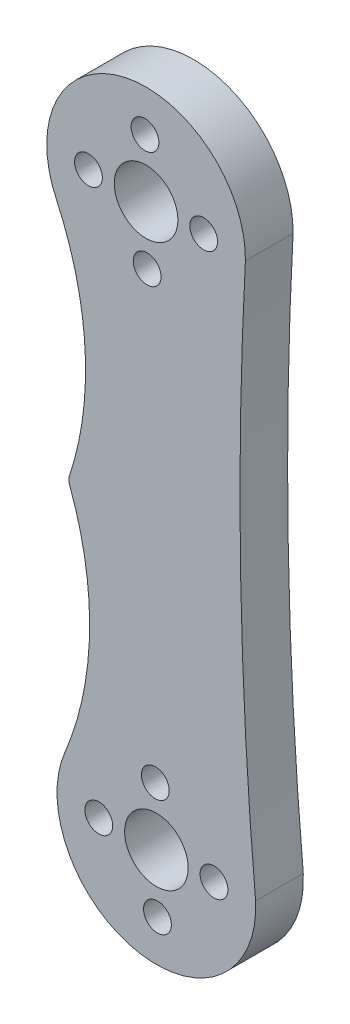
from build123d import *

# Parameters (mm, degrees)
SKETCH1_W           = 30
SKETCH1_H           = 100
BOSS_EXTRUDE1_DEPTH = 6
SKETCH2_W           = 30
SKETCH2_H           = 100
SKETCH2_R           = 4
SKETCH2_R_2         = 1.75
CUT_EXTRUDE1_DEPTH  = 6


with BuildPart() as part:
    # Sketch1 → Boss-Extrude1 (new body)
    with BuildSketch(Plane.XY):
        Rectangle(SKETCH1_W, SKETCH1_H)
    extrude(amount=BOSS_EXTRUDE1_DEPTH)

    # Sketch2 → Cut-Extrude1 (cut)
    # profile 1 of 11: a face of its own
    with BuildSketch(Plane(origin=(0, 0, 0), x_dir=(-1, 0, 0), z_dir=(0, 0, -1))):
        Rectangle(SKETCH2_W, SKETCH2_H)
        with BuildLine():
            ThreePointArc((-11.532456366, 35.433789865), (-10.931527192, 0.86004689), (-12.814966119, -33.667586637))
            ThreePointArc((-12.814966119, -33.667586637), (1.804726533, -46.658495876), (11.190763167, -29.50036508))
            ThreePointArc((11.190763167, -29.50036508), (8.075913228, -14.826459902), (10.585521288, -0.037016008))
            ThreePointArc((10.585521288, -0.037016008), (10.679689693, 0.458946393), (10.603989757, 0.958061522))
            ThreePointArc((10.603989757, 0.958061522), (8.644900126, 15.830443683), (12.302107664, 30.37866063))
            ThreePointArc((12.302107664, 30.37866063), (12.787952713, 31.585012611), (13.145828199, 32.835314836))
            ThreePointArc((13.145828199, 32.835314836), (2.274693549, 48.076541281), (-11.532456366, 35.433789865))
        make_face(mode=Mode.SUBTRACT)
    # profile 2 of 11: a face of its own
    with BuildSketch(Plane(origin=(0, 0, 0), x_dir=(-1, 0, 0), z_dir=(0, 0, -1))):
        with Locations((0.965754671, 35.645263027)):
            Circle(SKETCH2_R)
    # profile 3 of 11: a face of its own
    with BuildSketch(Plane(origin=(0, 0, 0), x_dir=(-1, 0, 0), z_dir=(0, 0, -1))):
        with Locations((1.100290264, 42.894014656)):
            Circle(SKETCH2_R_2)
    # profile 4 of 11: a face of its own
    with BuildSketch(Plane(origin=(0, 0, 0), x_dir=(-1, 0, 0), z_dir=(0, 0, -1))):
        with Locations((8.214506299, 35.510727434)):
            Circle(SKETCH2_R_2)
    # profile 5 of 11: a face of its own
    with BuildSketch(Plane(origin=(0, 0, 0), x_dir=(-1, 0, 0), z_dir=(0, 0, -1))):
        with Locations((0.831219078, 28.396511399)):
            Circle(SKETCH2_R_2)
    # profile 6 of 11: a face of its own
    with BuildSketch(Plane(origin=(0, 0, 0), x_dir=(-1, 0, 0), z_dir=(0, 0, -1))):
        with Locations((-6.282996958, 35.77979862)):
            Circle(SKETCH2_R_2)
    # profile 7 of 11: a face of its own
    with BuildSketch(Plane(origin=(0, 0, 0), x_dir=(-1, 0, 0), z_dir=(0, 0, -1))):
        with Locations((-0.333209676, -34.342683732)):
            Circle(SKETCH2_R)
    # profile 8 of 11: a face of its own
    with BuildSketch(Plane(origin=(0, 0, 0), x_dir=(-1, 0, 0), z_dir=(0, 0, -1))):
        with Locations((-0.198674083, -27.093932103)):
            Circle(SKETCH2_R_2)
    # profile 9 of 11: a face of its own
    with BuildSketch(Plane(origin=(0, 0, 0), x_dir=(-1, 0, 0), z_dir=(0, 0, -1))):
        with Locations((6.915541953, -34.477219325)):
            Circle(SKETCH2_R_2)
    # profile 10 of 11: a face of its own
    with BuildSketch(Plane(origin=(0, 0, 0), x_dir=(-1, 0, 0), z_dir=(0, 0, -1))):
        with Locations((-7.581961304, -34.208148139)):
            Circle(SKETCH2_R_2)
    # profile 11 of 11: a face of its own
    with BuildSketch(Plane(origin=(0, 0, 0), x_dir=(-1, 0, 0), z_dir=(0, 0, -1))):
        with Locations((-0.467745269, -41.591435361)):
            Circle(SKETCH2_R_2)
    extrude(amount=-CUT_EXTRUDE1_DEPTH, mode=Mode.SUBTRACT)


solid = part.part
